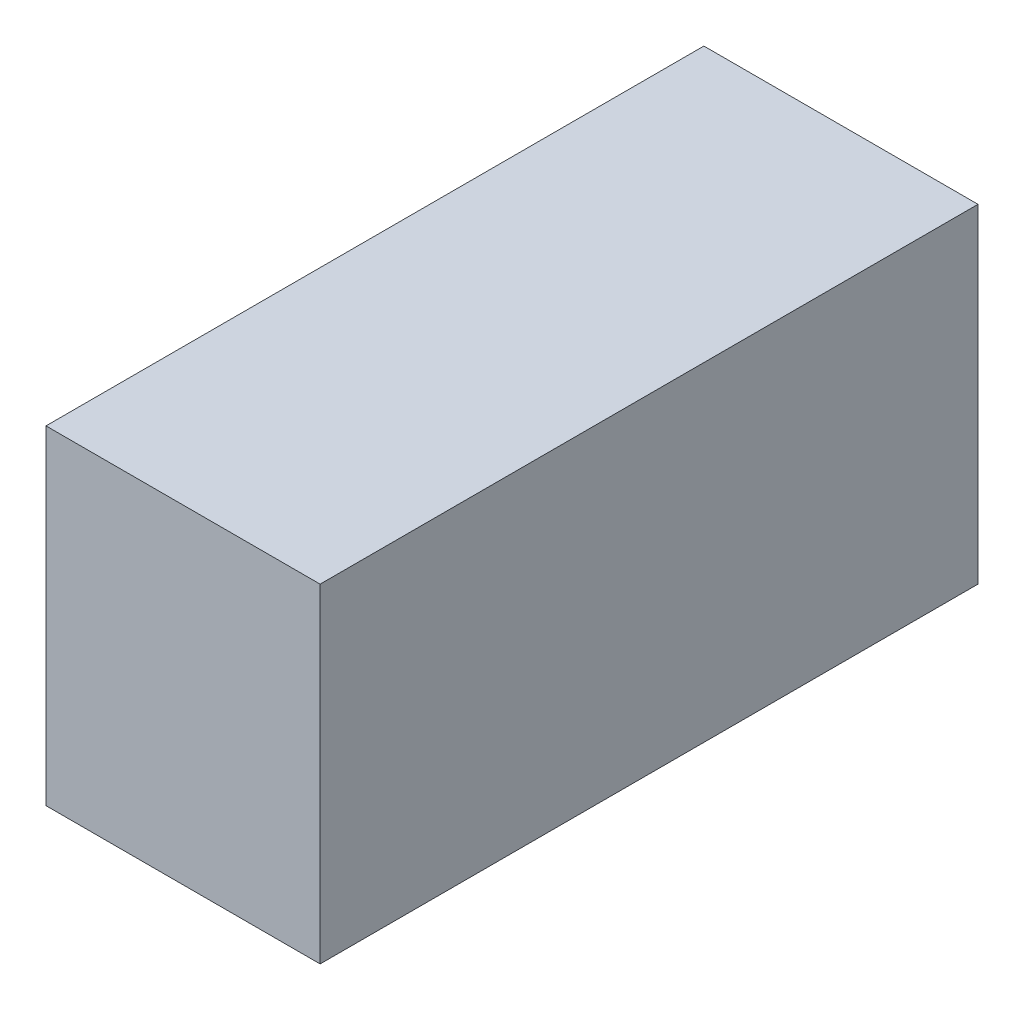
from build123d import *

# Parameters (mm, degrees)
SKETCH1_W           = 300
SKETCH1_H           = 150
BOSS_EXTRUDE1_DEPTH = 125


with BuildPart() as part:
    # Sketch1 → Boss-Extrude1 (new body)
    with BuildSketch(Plane(origin=(0, 0, 0), x_dir=(0, 0, -1), z_dir=(1, 0, 0))):
        with Locations((150, 75)):
            Rectangle(SKETCH1_W, SKETCH1_H)
    extrude(amount=BOSS_EXTRUDE1_DEPTH)


solid = part.part
